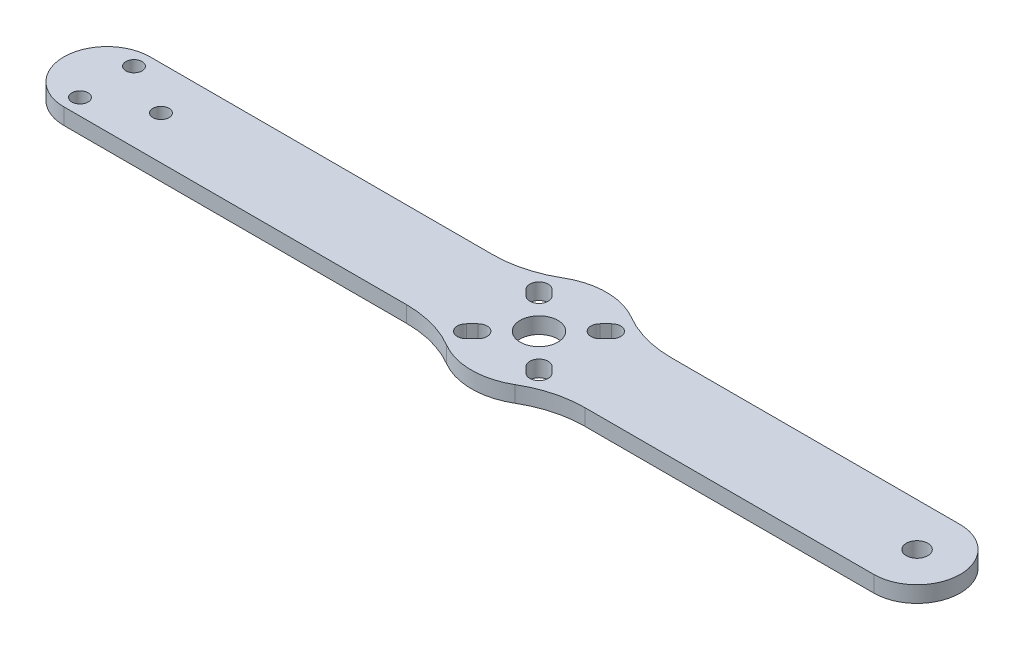
from build123d import *

# Parameters (mm, degrees)
EXTRUDE_1_DEPTH     = 3
SKETCH_8_R          = 12.5
EXTRUDE_2_DEPTH     = 3
SKETCH_2_R          = 3.5
CUT_EXTRUDE_1_DEPTH = 159.522080481
SKETCH_5_R          = 1.5
CUT_EXTRUDE_2_DEPTH = 159.522080481
FILLET_3_R          = 20
SKETCH_9_R          = 2
CUT_EXTRUDE_3_DEPTH = 159.522080481


with BuildPart() as part:
    # 草图1 → 凸台-拉伸1 (new body)
    with BuildSketch(Plane(origin=(0, 0, 0), x_dir=(1, 0, 0), z_dir=(0, 1, 0))):
        with BuildLine():
            Line((0, 8), (150, 8))
            ThreePointArc((150, 8), (158, 0), (150, -8))
            Line((150, -8), (0, -8))
            ThreePointArc((0, -8), (-8, 0), (0, 8))
        make_face()
    extrude(amount=EXTRUDE_1_DEPTH)

    # 草图8 → 凸台-拉伸2 (add)
    with BuildSketch(Plane(origin=(0, 3, 0), x_dir=(1, 0, 0), z_dir=(0, 1, 0))):
        with Locations((80, 0)):
            Circle(SKETCH_8_R)
    extrude(amount=-EXTRUDE_2_DEPTH)

    # 草图2 → 切除-拉伸1 (cut, through all)
    with BuildSketch(Plane(origin=(0, 3, 0), x_dir=(1, 0, 0), z_dir=(0, 1, 0))):
        with Locations(Location((80, 0, 0), (0, 0, 270))):
            Circle(SKETCH_2_R)
        with BuildLine():
            Line((84.456249475, 6.857459024), (85.516909647, 7.918119195))
            ThreePointArc((85.516909647, 7.918119195), (87.918119195, 7.918119195), (87.918119195, 5.516909647))
            Line((87.918119195, 5.516909647), (86.857459024, 4.456249475))
            ThreePointArc((86.857459024, 4.456249475), (84.456249475, 4.456249475), (84.456249475, 6.857459024))
        make_face()
        with BuildLine():
            Line((84.456249475, -6.857459024), (85.516909647, -7.918119195))
            ThreePointArc((85.516909647, -7.918119195), (87.918119195, -7.918119195), (87.918119195, -5.516909647))
            Line((87.918119195, -5.516909647), (86.857459024, -4.456249475))
            ThreePointArc((86.857459024, -4.456249475), (84.456249475, -4.456249475), (84.456249475, -6.857459024))
        make_face()
        with BuildLine():
            Line((73.142540976, -4.456249475), (72.081880805, -5.516909647))
            ThreePointArc((72.081880805, -5.516909647), (72.081880805, -7.918119195), (74.483090353, -7.918119195))
            Line((74.483090353, -7.918119195), (75.543750525, -6.857459024))
            ThreePointArc((75.543750525, -6.857459024), (75.543750525, -4.456249475), (73.142540976, -4.456249475))
        make_face()
        with BuildLine():
            Line((75.543750525, 6.857459024), (74.483090353, 7.918119195))
            ThreePointArc((74.483090353, 7.918119195), (72.081880805, 7.918119195), (72.081880805, 5.516909647))
            Line((72.081880805, 5.516909647), (73.142540976, 4.456249475))
            ThreePointArc((73.142540976, 4.456249475), (75.543750525, 4.456249475), (75.543750525, 6.857459024))
        make_face()
    extrude(amount=-CUT_EXTRUDE_1_DEPTH, mode=Mode.SUBTRACT)

    # 草图5 → 切除-拉伸2 (cut, through all)
    with BuildSketch(Plane(origin=(0, 3, 0), x_dir=(1, 0, 0), z_dir=(0, 1, 0))):
        with Locations(Location((10, 0, 0), (0, 0, 270))):
            Circle(SKETCH_5_R)
        with Locations(Location((0, 5, 0), (0, 0, 270))):
            Circle(SKETCH_5_R)
        with Locations(Location((0, -5, 0), (0, 0, 270))):
            Circle(SKETCH_5_R)
    extrude(amount=-CUT_EXTRUDE_2_DEPTH, mode=Mode.SUBTRACT)

    # 圆角3
    fillet_3_edges = [part.edges().sort_by_distance(p)[0] for p in [
        (70.395313644, 1.5, 8),
        (70.395313644, 1.5, -8),
        (89.604686356, 1.5, 8),
        (89.604686356, 1.5, -8),
    ]]
    fillet(fillet_3_edges, radius=FILLET_3_R)

    # 草图9 → 切除-拉伸3 (cut, through all)
    with BuildSketch(Plane(origin=(0, 3, 0), x_dir=(1, 0, 0), z_dir=(0, 1, 0))):
        with Locations(Location((150, 0, 0), (0, 0, 270))):
            Circle(SKETCH_9_R)
    extrude(amount=-CUT_EXTRUDE_3_DEPTH, mode=Mode.SUBTRACT)


solid = part.part
